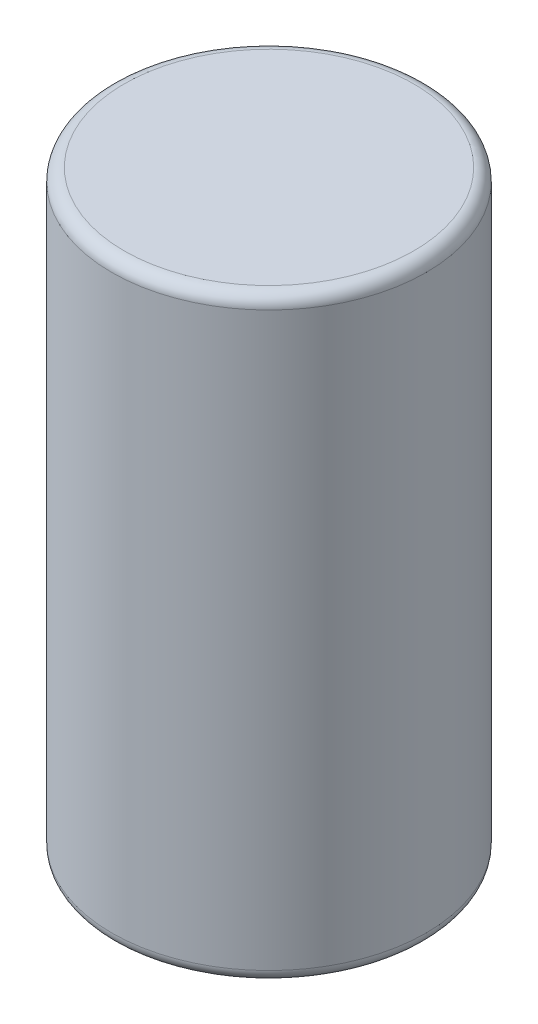
from build123d import *

# Parameters (mm, degrees)
SKETCH1_R           = 40.132
BOSS_EXTRUDE1_DEPTH = 152.4
FILLET1_R           = 3.175


with BuildPart() as part:
    # Sketch1 → Boss-Extrude1 (new body)
    with BuildSketch(Plane(origin=(0, 0, 0), x_dir=(1, 0, 0), z_dir=(0, 1, 0))):
        with Locations(Location((0, 0, 0), (0, 0, 90))):
            Circle(SKETCH1_R)
    extrude(amount=BOSS_EXTRUDE1_DEPTH)

    # Fillet1
    fillet1_edges = [part.edges().sort_by_distance(p)[0] for p in [
        (0, 0, 40.132),
        (0, 152.4, 40.132),
    ]]
    fillet(fillet1_edges, radius=FILLET1_R)


solid = part.part
